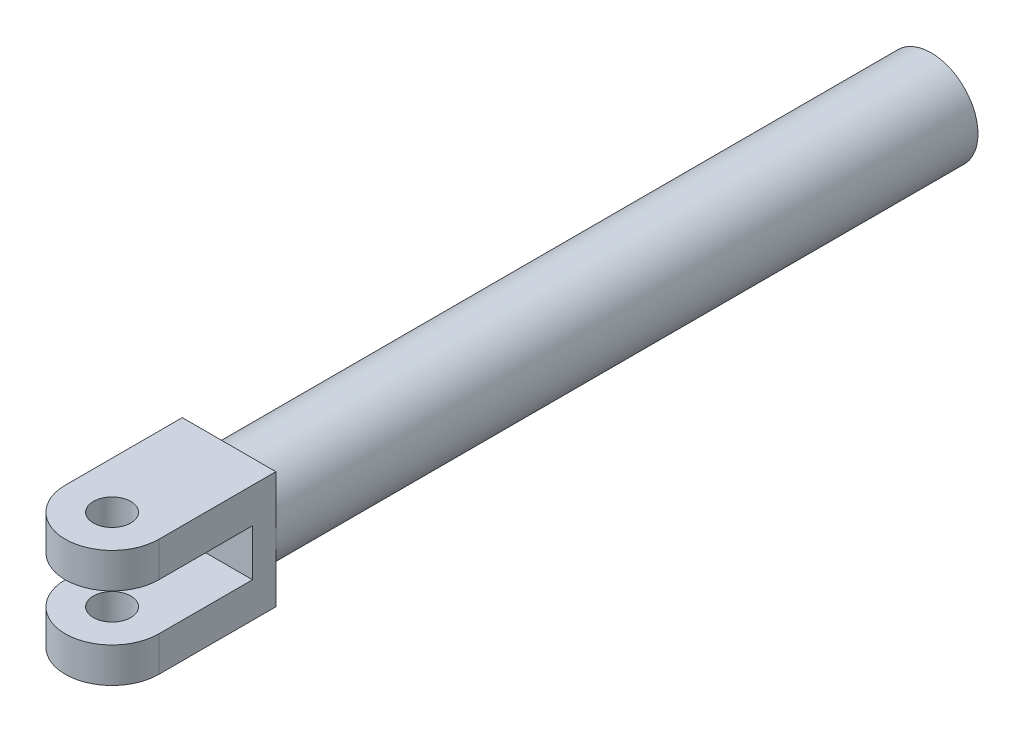
from build123d import *

# Parameters (mm, degrees)
SKETCH_2_R          = 10
EXTRUDE_1_DEPTH     = 150
SKETCH_3_W          = 20
SKETCH_3_H          = 25
EXTRUDE_2_DEPTH     = 35
SKETCH_4_W          = 60
SKETCH_4_H          = 10
CUT_EXTRUDE_1_DEPTH = 50
SKETCH_5_R          = 4
CUT_EXTRUDE_2_DEPTH = 50
FILLET_3_RADIUS     = 10
FILLET_3_LENGTH     = 7.5
FILLET_4_RADIUS     = 10
FILLET_4_LENGTH     = 7.5


with BuildPart() as part:
    # 草图2 → 凸台-拉伸1 (new body)
    with BuildSketch(Plane.XY):
        Circle(SKETCH_2_R)
    extrude(amount=EXTRUDE_1_DEPTH)

    # 草图3 → 凸台-拉伸2 (add)
    with BuildSketch(Plane.XY.offset(150)):
        Rectangle(SKETCH_3_W, SKETCH_3_H)
    extrude(amount=EXTRUDE_2_DEPTH)

    # 草图4 → 切除-拉伸1 (cut)
    with BuildSketch(Plane.ZY.offset(10)):
        with Locations((185, 0)):
            Rectangle(SKETCH_4_W, SKETCH_4_H)
    extrude(amount=-CUT_EXTRUDE_1_DEPTH, mode=Mode.SUBTRACT)

    # 草图5 → 切除-拉伸2 (cut)
    with BuildSketch(Plane.XZ.offset(12.5)):
        with Locations(Location((0, 175, 0), (0, 0, 270))):
            Circle(SKETCH_5_R)
    extrude(amount=-CUT_EXTRUDE_2_DEPTH, mode=Mode.SUBTRACT)

    # 圆角3: full round fillet: the end face becomes a half cylinder, R = half its width
    fillet_3_face = Plane((0, -8.75, 185), x_dir=(0, -1, 0), z_dir=(0, 0, 1))  # on the end face: x along it, z out of the body
    fillet_3_slab = fillet_3_face.offset(-FILLET_3_RADIUS / 2) * Box(FILLET_3_LENGTH, 2 * FILLET_3_RADIUS, FILLET_3_RADIUS, mode=Mode.PRIVATE)  # the body's end, R deep
    fillet_3_round = Plane((0, -8.75, 175), x_dir=(0, 0, 1), z_dir=(0, -1, 0)) * Cylinder(FILLET_3_RADIUS, FILLET_3_LENGTH, mode=Mode.PRIVATE)  # its axis R under the face
    add(fillet_3_slab - fillet_3_round, mode=Mode.SUBTRACT)

    # 圆角4: full round fillet: the end face becomes a half cylinder, R = half its width
    fillet_4_face = Plane((0, 8.75, 185), x_dir=(0, 1, 0), z_dir=(0, 0, 1))  # on the end face: x along it, z out of the body
    fillet_4_slab = fillet_4_face.offset(-FILLET_4_RADIUS / 2) * Box(FILLET_4_LENGTH, 2 * FILLET_4_RADIUS, FILLET_4_RADIUS, mode=Mode.PRIVATE)  # the body's end, R deep
    fillet_4_round = Plane((0, 8.75, 175), x_dir=(0, 0, 1), z_dir=(0, 1, 0)) * Cylinder(FILLET_4_RADIUS, FILLET_4_LENGTH, mode=Mode.PRIVATE)  # its axis R under the face
    add(fillet_4_slab - fillet_4_round, mode=Mode.SUBTRACT)


solid = part.part
